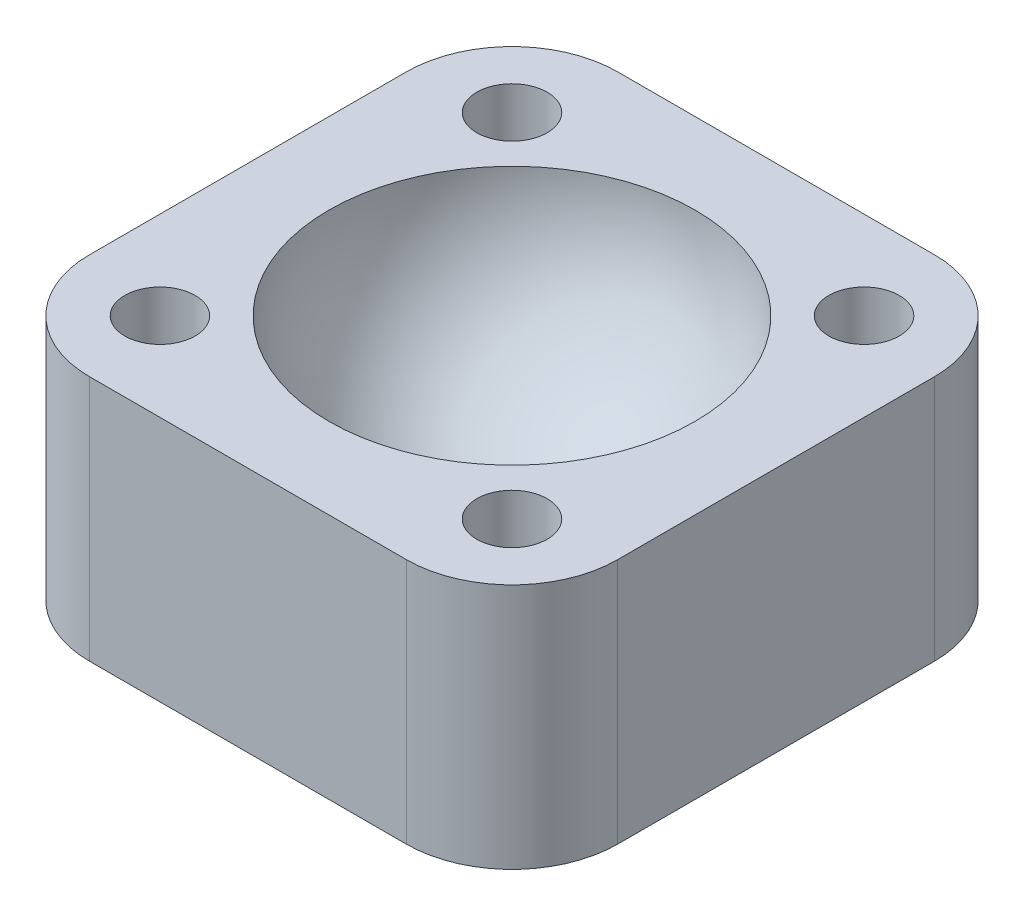
from build123d import *

# Parameters (mm, degrees)
SKETCH1_W           = 15
SKETCH1_H           = 15
BOSS_EXTRUDE1_DEPTH = 7
SKETCH3_R           = 1
CUT_EXTRUDE1_DEPTH  = 23.338307904
FILLET1_R           = 3


with BuildPart() as part:
    # Sketch1 → Boss-Extrude1 (new body)
    with BuildSketch(Plane(origin=(0, 0, 0), x_dir=(1, 0, 0), z_dir=(0, 1, 0))):
        with Locations((7.5, -7.5)):
            Rectangle(SKETCH1_W, SKETCH1_H)
    extrude(amount=BOSS_EXTRUDE1_DEPTH)

    # Sketch2 → Cut-Revolve1 (revolve, cut)
    with BuildSketch(Plane(origin=(0, 7, 0), x_dir=(1, 0, 0), z_dir=(0, 1, 0))):
        with BuildLine():
            Line((12.7, -7.5), (2.3, -7.5))
            ThreePointArc((2.3, -7.5), (7.5, -12.7), (12.7, -7.5))
        make_face()
    revolve(axis=Axis((12.7, 7, 7.5), (-1, 0, 0)), mode=Mode.SUBTRACT)

    # Sketch3 → Cut-Extrude1 (cut, through all)
    with BuildSketch(Plane(origin=(0, 7, 0), x_dir=(1, 0, 0), z_dir=(0, 1, 0))):
        with Locations(Location((2.5, -12.5, 0), (0, 0, 270))):
            Circle(SKETCH3_R)
        with Locations(Location((12.5, -12.5, 0), (0, 0, 270))):
            Circle(SKETCH3_R)
        with Locations(Location((12.5, -2.5, 0), (0, 0, 270))):
            Circle(SKETCH3_R)
        with Locations(Location((2.5, -2.5, 0), (0, 0, 270))):
            Circle(SKETCH3_R)
    extrude(amount=-CUT_EXTRUDE1_DEPTH, mode=Mode.SUBTRACT)

    # Fillet1
    fillet1_edges = [part.edges().sort_by_distance(p)[0] for p in [
        (0, 3.5, 0),
        (15, 3.5, 0),
        (15, 3.5, 15),
        (0, 3.5, 15),
    ]]
    fillet(fillet1_edges, radius=FILLET1_R)


solid = part.part
